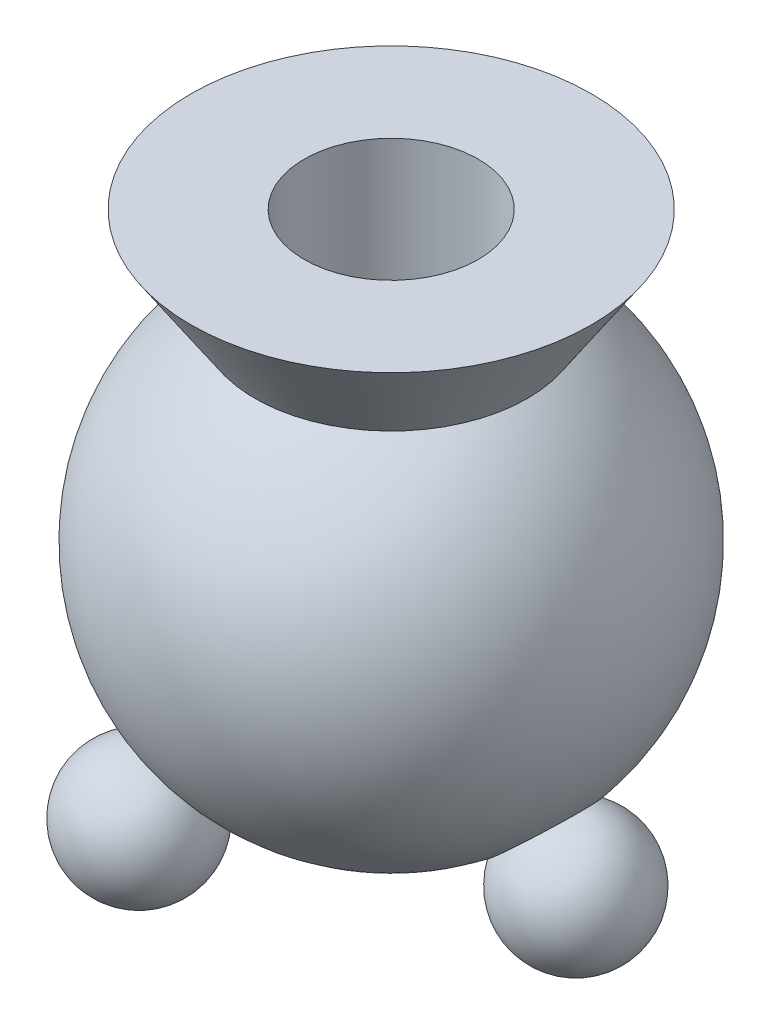
from build123d import *

# Parameters (mm, degrees)
CIRPATTERN1_COUNT = 3


with BuildPart() as part:
    # Sketch1 → Revolve1 (revolve)
    with BuildSketch(Plane.XY):
        with BuildLine():
            Line((0, 0), (0, 40))
            Line((0, 40), (10, 40))
            Line((10, 40), (10, 60))
            Line((10, 60), (23, 60))
            Line((23, 60), (15.652475842, 49))
            ThreePointArc((15.652475842, 49), (25.719642299, 18.784161637), (0, 0))
        make_face()
    revolve(axis=Axis((0, 0, 0), (0, 1, 0)))

    # Sketch2 → Revolve2 (revolve)
    with BuildSketch(Plane.XY):
        with BuildLine():
            Line((15.909902577, 8.590097423), (26.516504294, -2.016504294))
            ThreePointArc((26.516504294, -2.016504294), (26.516504294, 8.590097423), (15.909902577, 8.590097423))
        make_face()
    revolve2 = revolve(axis=Axis((15.909902577, 8.590097423, 0), (0.707106781186544, -0.7071067811865511, 0)))

    # CirPattern1: Revolve2 ×3 about axis
    cirpattern1_axis = Axis((0, 0, 0), (0, 1, 0))
    for i in range(1, CIRPATTERN1_COUNT):
        add(revolve2.rotate(cirpattern1_axis, i * 360 / CIRPATTERN1_COUNT))


solid = part.part
